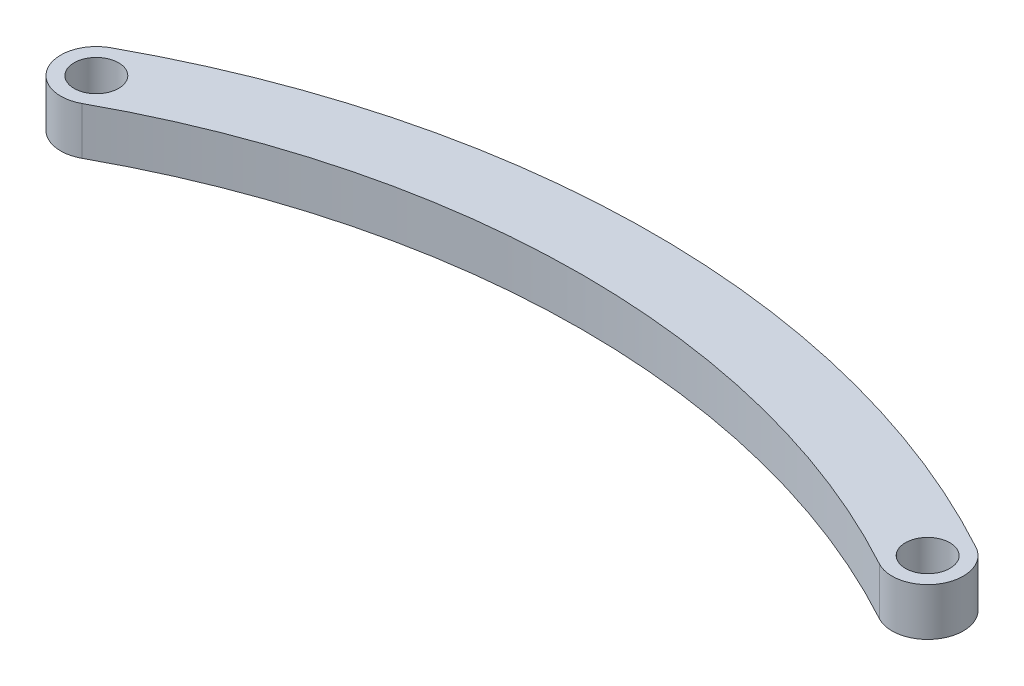
from build123d import *

# Parameters (mm, degrees)
ESQUISSE1_R        = 1.875
BOSS_EXTRU_1_DEPTH = 4


with BuildPart() as part:
    # Esquisse1 → Boss.-Extru.1 (new body)
    with BuildSketch(Plane(origin=(0, 0, 0), x_dir=(1, 0, 0), z_dir=(0, 1, 0))):
        with BuildLine():
            ThreePointArc((-36.438356038, 2.632704296), (-37.632704242, -1.438356135), (-33.561643767, -2.632704189))
            ThreePointArc((-33.561643767, -2.632704189), (6.8e-08, 5.937530488), (33.561643886, -2.632704254))
            ThreePointArc((33.561643886, -2.632704254), (37.632704286, -1.438356055), (36.438355996, 2.632704318))
            ThreePointArc((36.438355996, 2.632704318), (-2.4e-08, 11.937530488), (-36.438356038, 2.632704296))
        make_face()
        with Locations(Location((-35, 0, 0), (0, 0, 270))):
            Circle(ESQUISSE1_R, mode=Mode.SUBTRACT)
        with Locations(Location((35, 0, 0), (0, 0, 270))):
            Circle(ESQUISSE1_R, mode=Mode.SUBTRACT)
    extrude(amount=BOSS_EXTRU_1_DEPTH)


solid = part.part
